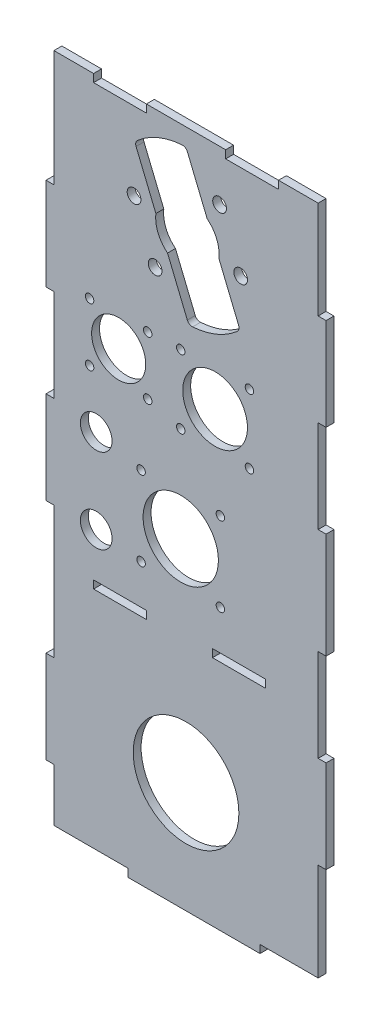
from build123d import *

# Parameters (mm, degrees)
SKETCH1_W           = 100
SKETCH1_H           = 254
BOSS_EXTRUDE1_DEPTH = 3
SKETCH2_W           = 3
SKETCH2_H           = 35
SKETCH2_H_2         = 40
BOSS_EXTRUDE2_DEPTH = 3
SKETCH3_W           = 20
SKETCH3_H           = 3
CUT_EXTRUDE1_DEPTH  = 3
SKETCH4_W           = 20
SKETCH4_H           = 3
CUT_EXTRUDE2_DEPTH  = 3
SKETCH5_R           = 20
SKETCH5_R_2         = 10.25
SKETCH5_R_3         = 1.6
SKETCH5_R_4         = 14.25
SKETCH5_R_5         = 12.25
SKETCH5_R_6         = 2.6
SKETCH5_R_7         = 6
CUT_EXTRUDE3_DEPTH  = 3
SKETCH6_W           = 50
SKETCH6_H           = 3
BOSS_EXTRUDE3_DEPTH = 3
SKETCH8_W           = 3
SKETCH8_H           = 35
BOSS_EXTRUDE4_DEPTH = 3


with BuildPart() as part:
    # Sketch1 → Boss-Extrude1 (new body)
    with BuildSketch(Plane.XY):
        Rectangle(SKETCH1_W, SKETCH1_H)
    extrude(amount=BOSS_EXTRUDE1_DEPTH)

    # Sketch2 → Boss-Extrude2 (add)
    with BuildSketch(Plane(origin=(50, 0, 0), x_dir=(0, 0, -1), z_dir=(1, 0, 0))):
        with Locations((-1.5, 72.5)):
            Rectangle(SKETCH2_W, SKETCH2_H)
        with Locations((-1.5, 0)):
            Rectangle(SKETCH2_W, SKETCH2_H_2)
        with Locations((-1.5, -72.5)):
            Rectangle(SKETCH2_W, SKETCH2_H)
    extrude(amount=BOSS_EXTRUDE2_DEPTH)

    # Sketch3 → Cut-Extrude1 (cut)
    with BuildSketch(Plane(origin=(0, 127, 0), x_dir=(1, 0, 0), z_dir=(0, 1, 0))):
        with Locations((25, -1.5)):
            Rectangle(SKETCH3_W, SKETCH3_H)
        with Locations((-25, -1.5)):
            Rectangle(SKETCH3_W, SKETCH3_H)
    extrude(amount=-CUT_EXTRUDE1_DEPTH, mode=Mode.SUBTRACT)

    # Sketch4 → Cut-Extrude2 (cut)
    with BuildSketch(Plane.XY.offset(3)):
        with Locations((-25, -40.5)):
            Rectangle(SKETCH4_W, SKETCH4_H)
        with Locations((20, -40.5)):
            Rectangle(SKETCH4_W, SKETCH4_H)
    extrude(amount=-CUT_EXTRUDE2_DEPTH, mode=Mode.SUBTRACT)

    # Sketch5 → Cut-Extrude3 (cut)
    with BuildSketch(Plane.XY.offset(3)):
        with Locations((0, -88)):
            Circle(SKETCH5_R)
        with Locations((-25.5, 41.5)):
            Circle(SKETCH5_R_2)
        with Locations((-36.5, 52.5)):
            Circle(SKETCH5_R_3)
        with Locations((-14.5, 52.5)):
            Circle(SKETCH5_R_3)
        with Locations((-36.5, 30.5)):
            Circle(SKETCH5_R_3)
        with Locations((-14.5, 30.5)):
            Circle(SKETCH5_R_3)
        with Locations((-17, 6)):
            Circle(SKETCH5_R_3)
        with Locations((13, 6)):
            Circle(SKETCH5_R_3)
        with Locations((-17, -24)):
            Circle(SKETCH5_R_3)
        with Locations((13, -24)):
            Circle(SKETCH5_R_3)
        with Locations((-2, -9)):
            Circle(SKETCH5_R_4)
        with Locations((11, 40)):
            Circle(SKETCH5_R_5)
        with Locations((-2, 53)):
            Circle(SKETCH5_R_3)
        with Locations((24, 53)):
            Circle(SKETCH5_R_3)
        with Locations((24, 27)):
            Circle(SKETCH5_R_3)
        with Locations((-2, 27)):
            Circle(SKETCH5_R_3)
        with Locations(Location((-19.67760104, 94.560133375, 0), (0, 0, 180))):
            Circle(SKETCH5_R_6)
        with Locations(Location((-11.69545935, 75.136297141, 0), (0, 0, 180))):
            Circle(SKETCH5_R_6)
        with Locations(Location((12.69545935, 107.863702859, 0), (0, 0, 180))):
            Circle(SKETCH5_R_6)
        with Locations(Location((20.67760104, 88.439866625, 0), (0, 0, 180))):
            Circle(SKETCH5_R_6)
        with Locations((-34, 10)):
            Circle(SKETCH5_R_7)
        with Locations((-34, -22)):
            Circle(SKETCH5_R_7)
        with BuildLine():
            Line((8.003725129, 100.864513292), (0.511048213, 119.097280263))
            ThreePointArc((0.511048213, 119.097280263), (-0.28284909, 120.035570092), (-1.475557752, 120.33239795))
            ThreePointArc((-1.475557752, 120.33239795), (-10.484947373, 118.230898436), (-18.368690592, 113.3902379))
            ThreePointArc((-18.368690592, 113.3902379), (-19.008046594, 112.340530973), (-18.912788021, 111.115138573))
            Line((-18.912788021, 111.115138573), (-11.420111105, 92.882371602))
            ThreePointArc((-11.420111105, 92.882371602), (-10.599334991, 86.938776177), (-7.003725129, 82.135486708))
            Line((-7.003725129, 82.135486708), (0.488951787, 63.902719737))
            ThreePointArc((0.488951787, 63.902719737), (1.28284909, 62.964429908), (2.475557752, 62.66760205))
            ThreePointArc((2.475557752, 62.66760205), (11.484947373, 64.769101564), (19.368690592, 69.6097621))
            ThreePointArc((19.368690592, 69.6097621), (20.008046594, 70.659469027), (19.912788021, 71.884861427))
            Line((19.912788021, 71.884861427), (12.420111105, 90.117628398))
            ThreePointArc((12.420111105, 90.117628398), (11.599334991, 96.061223823), (8.003725129, 100.864513292))
        make_face()
    extrude(amount=-CUT_EXTRUDE3_DEPTH, mode=Mode.SUBTRACT)

    # Sketch6 → Boss-Extrude3 (add)
    with BuildSketch(Plane.XZ.offset(127)):
        with Locations((3, 1.5)):
            Rectangle(SKETCH6_W, SKETCH6_H)
    extrude(amount=BOSS_EXTRUDE3_DEPTH)

    # Sketch8 → Boss-Extrude4 (add)
    with BuildSketch(Plane.ZY.offset(50)):
        with Locations((1.5, -89.5)):
            Rectangle(SKETCH8_W, SKETCH8_H)
        with Locations((1.5, -4.5)):
            Rectangle(SKETCH8_W, SKETCH8_H)
        with Locations((1.5, 65.5)):
            Rectangle(SKETCH8_W, SKETCH8_H)
    extrude(amount=BOSS_EXTRUDE4_DEPTH)


solid = part.part
